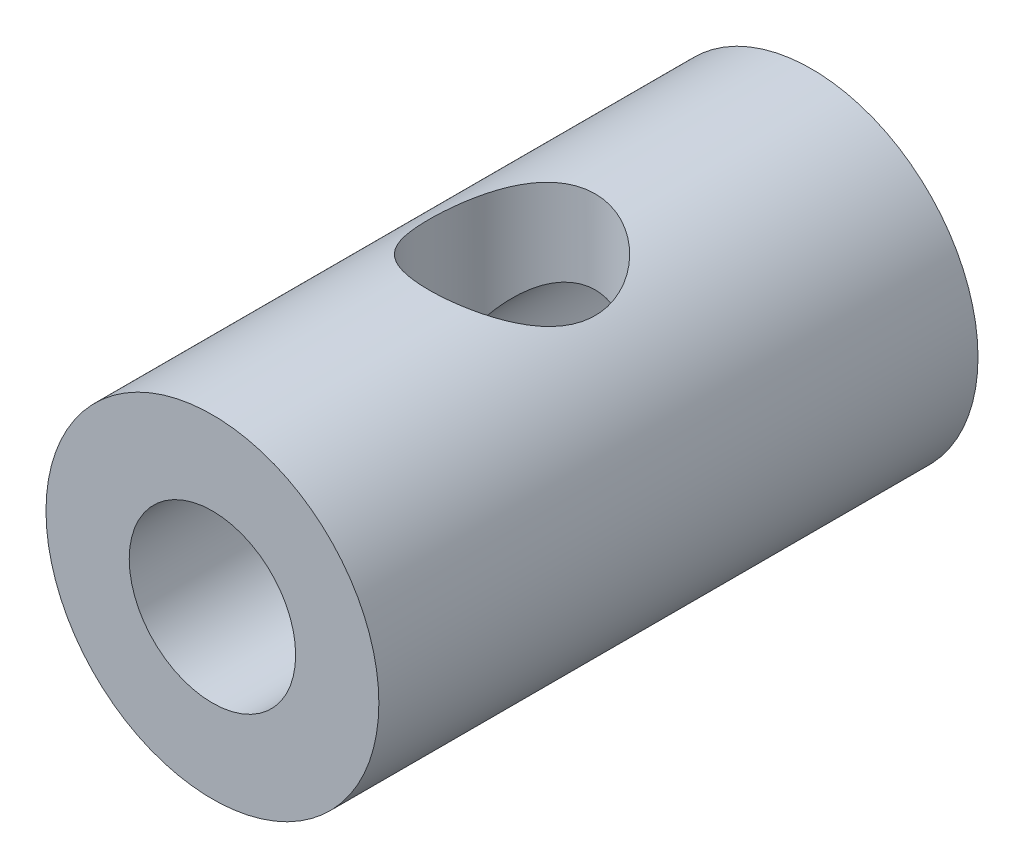
from build123d import *

# Parameters (mm, degrees)
SKETCH1_R               = 50
SKETCH1_R_2             = 25
BOSS_EXTRUDE1_DEPTH     = 90
CUT_EXTRUDE1_DEPTH      = 115.455231423
CUT_EXTRUDE1_DEPTH_BACK = 115.455231423
SKETCH2_R               = 25


with BuildPart() as part:
    # Sketch1 → Boss-Extrude1 (new, symmetric)
    with BuildSketch(Plane.XY):
        with Locations(Location((0, 0, 0), (0, 0, 180))):
            Circle(SKETCH1_R)
        with Locations(Location((0, 0, 0), (0, 0, 180))):
            Circle(SKETCH1_R_2, mode=Mode.SUBTRACT)
    extrude(amount=BOSS_EXTRUDE1_DEPTH, both=True)

    # Sketch2 → Cut-Extrude1 (cut, two sides: drawn at the far end of the back side and taken through both)
    with BuildSketch(Plane(origin=(0, 0, 0), x_dir=(1, 0, 0), z_dir=(0, 1, 0)).offset(-CUT_EXTRUDE1_DEPTH_BACK)):
        with Locations(Location((0, 0, 0), (0, 0, 270))):
            Circle(SKETCH2_R)
    extrude(amount=CUT_EXTRUDE1_DEPTH + CUT_EXTRUDE1_DEPTH_BACK, mode=Mode.SUBTRACT)


solid = part.part
